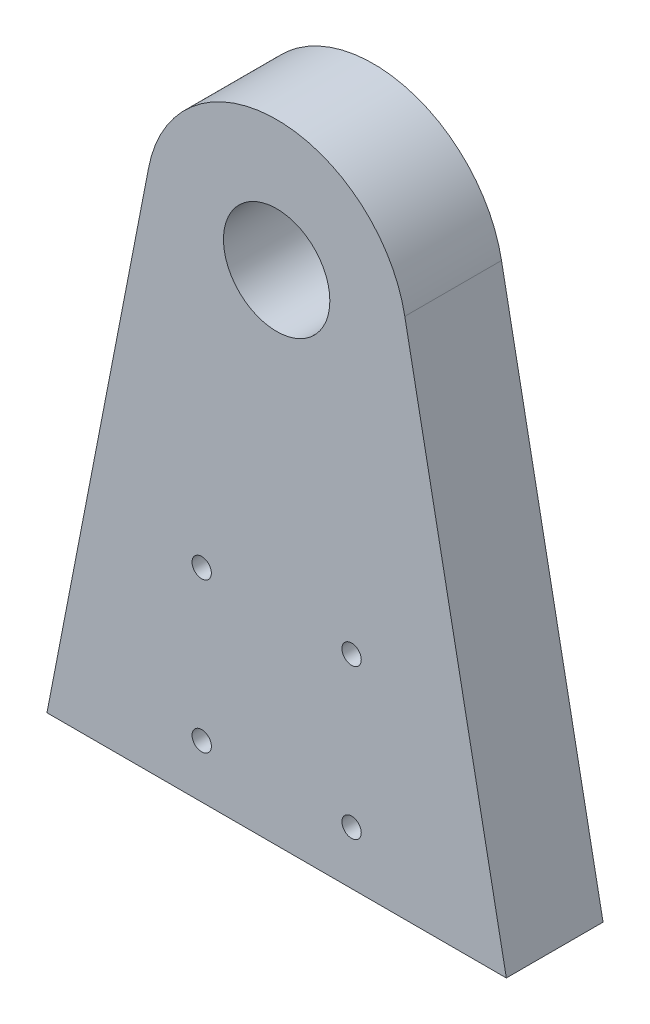
from build123d import *

# Parameters (mm, degrees)
ESQUISSE1_R             = 11
BOSS_EXTRU_1_DEPTH      = 20
ESQUISSE2_R             = 2
ENL_V_MAT_EXTRU_1_DEPTH = 163.249807396


with BuildPart() as part:
    # Esquisse1 → Boss.-Extru.1 (new body)
    with BuildSketch(Plane.XY):
        with BuildLine():
            Line((0, 0), (95, 0))
            Line((95, 0), (74, 108))
            ThreePointArc((74, 108), (47.5, 130), (21, 108))
            Line((21, 108), (0, 0))
        make_face()
        with Locations((47.5, 103.039772727)):
            Circle(ESQUISSE1_R, mode=Mode.SUBTRACT)
    extrude(amount=BOSS_EXTRU_1_DEPTH)

    # Esquisse2 → Enlèv. mat.-Extru.1 (cut, through all)
    with BuildSketch(Plane.XY.offset(20)):
        with Locations((63, 11)):
            Circle(ESQUISSE2_R)
        with Locations((32, 11)):
            Circle(ESQUISSE2_R)
        with Locations((32, 42)):
            Circle(ESQUISSE2_R)
        with Locations((63, 42)):
            Circle(ESQUISSE2_R)
    extrude(amount=-ENL_V_MAT_EXTRU_1_DEPTH, mode=Mode.SUBTRACT)


solid = part.part
